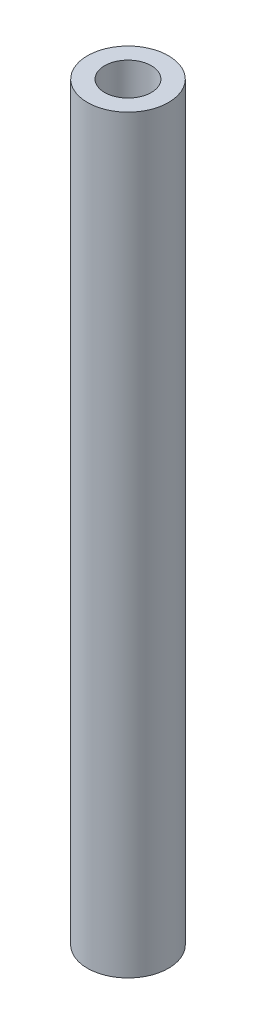
from build123d import *

# Parameters (mm, degrees)
SKETCH1_R           = 2
BOSS_EXTRUDE1_DEPTH = 37
SKETCH2_R           = 1.15
CUT_EXTRUDE1_DEPTH  = 38.107950631


with BuildPart() as part:
    # Sketch1 → Boss-Extrude1 (new body)
    with BuildSketch(Plane(origin=(0, 0, 0), x_dir=(1, 0, 0), z_dir=(0, 1, 0))):
        with Locations(Location((0, 0, 0), (0, 0, 270))):
            Circle(SKETCH1_R)
    extrude(amount=BOSS_EXTRUDE1_DEPTH)

    # Sketch2 → Cut-Extrude1 (cut, through all)
    with BuildSketch(Plane.XZ):
        with Locations(Location((0, 0, 0), (0, 0, 270))):
            Circle(SKETCH2_R)
    extrude(amount=-CUT_EXTRUDE1_DEPTH, mode=Mode.SUBTRACT)


solid = part.part
